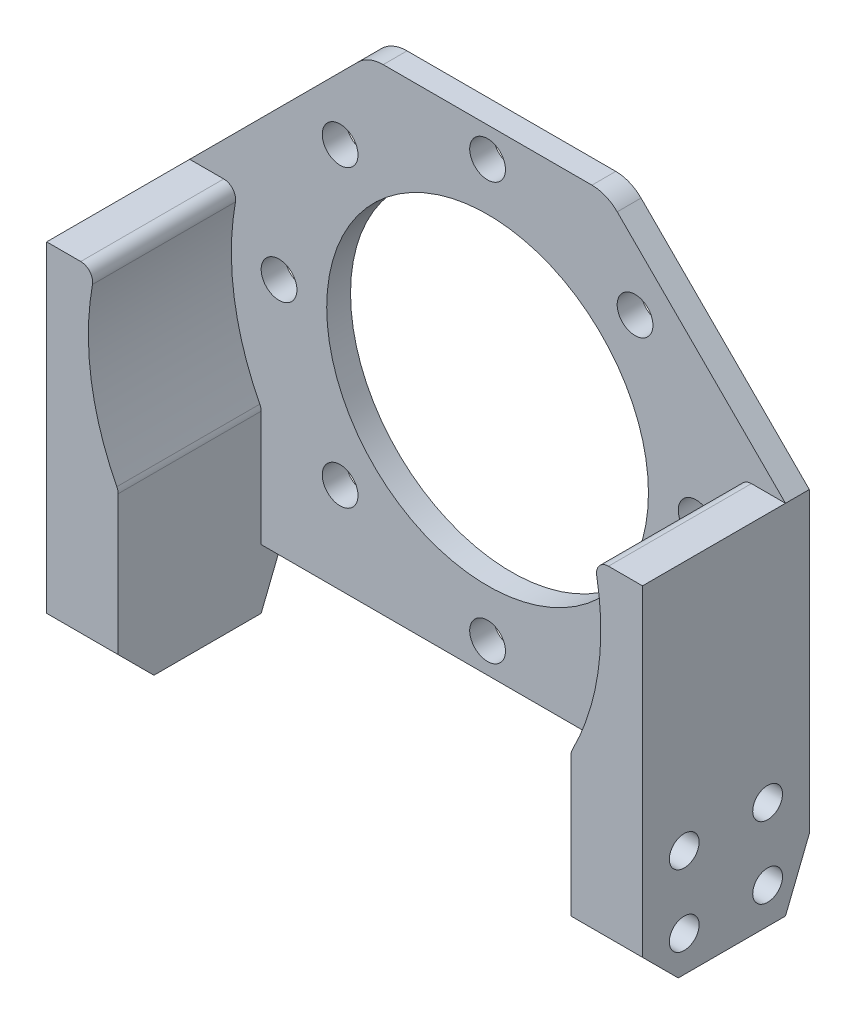
from build123d import *
from build123d.topology import SkipClean

# Parameters (mm, degrees)
SKETCH_1_W          = 50
SKETCH_1_H          = 50
SKETCH_1_R          = 21.5
SKETCH_1_R_2        = 13.5
SKETCH_1_R_3        = 1.5
EXTRUDE_1_DEPTH     = 8
SKETCH_2_R          = 21.5
CUT_EXTRUDE_1_DEPTH = 6
SKETCH_3_W          = 50
SKETCH_3_H          = 5
CUT_EXTRUDE_2_DEPTH = 27
CUT_EXTRUDE_3_DEPTH = 10
SKETCH_5_W          = 59.949446365
SKETCH_5_H          = 15
CUT_EXTRUDE_4_DEPTH = 6
SKETCH_6_R          = 13.5
CUT_EXTRUDE_5_DEPTH = 10
SKETCH_7_W          = 38
SKETCH_7_H          = 25.671468353
CUT_EXTRUDE_6_DEPTH = 6
EXTRUDE_START       = 6
EXTRUDE_2_DEPTH     = 6
SKETCH_9_R          = 1.25
CUT_EXTRUDE_7_DEPTH = 5
FILLET_1_R          = 1
FILLET_2_R          = 3
CHAMFER_1_SIZE      = 3
CUT_EXTRUDE_8_DEPTH = 51
CUT_EXTRUDE_9_DEPTH = 38


with BuildPart() as part:
    # 草图1 → 凸台-拉伸1 (new body)
    # profile 1 of 3: a face of its own
    with BuildSketch(Plane.XY):
        Rectangle(SKETCH_1_W, SKETCH_1_H)
        Circle(SKETCH_1_R, mode=Mode.SUBTRACT)
    # profile 2 of 3: a face of its own
    with BuildSketch(Plane.XY):
        Circle(SKETCH_1_R)
        Circle(SKETCH_1_R_2, mode=Mode.SUBTRACT)
        with Locations((0, 17.5)):
            Circle(SKETCH_1_R_3, mode=Mode.SUBTRACT)
        with Locations((12.374368671, 12.374368671)):
            Circle(SKETCH_1_R_3, mode=Mode.SUBTRACT)
        with Locations((17.5, 0)):
            Circle(SKETCH_1_R_3, mode=Mode.SUBTRACT)
        with Locations((12.374368671, -12.374368671)):
            Circle(SKETCH_1_R_3, mode=Mode.SUBTRACT)
        with Locations((0, -17.5)):
            Circle(SKETCH_1_R_3, mode=Mode.SUBTRACT)
        with Locations((-12.374368671, -12.374368671)):
            Circle(SKETCH_1_R_3, mode=Mode.SUBTRACT)
        with Locations((-17.5, 0)):
            Circle(SKETCH_1_R_3, mode=Mode.SUBTRACT)
        with Locations((-12.374368671, 12.374368671)):
            Circle(SKETCH_1_R_3, mode=Mode.SUBTRACT)
    # profile 3 of 3: a face of its own
    with BuildSketch(Plane.XY):
        Circle(SKETCH_1_R_2)
    extrude(amount=EXTRUDE_1_DEPTH)

    # 草图2 → 切除-拉伸1 (cut)
    with BuildSketch(Plane.XY.offset(8)):
        Circle(SKETCH_2_R)
    extrude(amount=-CUT_EXTRUDE_1_DEPTH, mode=Mode.SUBTRACT)

    # 草图3 → 切除-拉伸2 (cut)
    with BuildSketch(Plane.XY.offset(8)):
        with Locations((0, 22.5)):
            Rectangle(SKETCH_3_W, SKETCH_3_H)
    extrude(amount=-CUT_EXTRUDE_2_DEPTH, mode=Mode.SUBTRACT)

    # 草图4 → 切除-拉伸3 (cut)
    with BuildSketch(Plane.XY.offset(8)):
        Polygon((-25, 5), (-25, 20), (-10, 20), align=None)
        Polygon((10, 20), (25, 5), (25, 20), align=None)
    extrude(amount=-CUT_EXTRUDE_3_DEPTH, mode=Mode.SUBTRACT)

    # 草图5 → 切除-拉伸4 (cut)
    with BuildSketch(Plane.XY.offset(8)):
        with Locations((-0.284795469, 12.5)):
            Rectangle(SKETCH_5_W, SKETCH_5_H)
    extrude(amount=-CUT_EXTRUDE_4_DEPTH, mode=Mode.SUBTRACT)

    # 草图6 → 切除-拉伸5 (cut)
    with BuildSketch(Plane.XY.offset(2)):
        Circle(SKETCH_6_R)
    extrude(amount=-CUT_EXTRUDE_5_DEPTH, mode=Mode.SUBTRACT)

    # 草图7 → 切除-拉伸6 (cut)
    with BuildSketch(Plane.XY.offset(8)):
        with Locations((0, -22.898040076)):
            Rectangle(SKETCH_7_W, SKETCH_7_H)
    extrude(amount=-CUT_EXTRUDE_6_DEPTH, mode=Mode.SUBTRACT)

    # 草图8 → 凸台-拉伸2 (add)
    with BuildSketch(Plane.XY.offset(8).offset(EXTRUDE_START)):
        with BuildLine():
            Line((19, -10.062305899), (19, -25))
            Line((19, -25), (25, -25))
            Line((25, -25), (25, 5))
            Line((25, 5), (20.910523666, 5))
            ThreePointArc((20.910523666, 5), (21.329105457, -2.70541317), (19, -10.062305899))
        make_face()
        with BuildLine():
            Line((-19, -25), (-19, -10.062305899))
            ThreePointArc((-19, -10.062305899), (-21.329105457, -2.70541317), (-20.910523666, 5))
            Line((-20.910523666, 5), (-25, 5))
            Line((-25, 5), (-25, -25))
            Line((-25, -25), (-19, -25))
        make_face()
    extrude(amount=-EXTRUDE_2_DEPTH)

    # 草图9 → 切除-拉伸7 (cut)
    with SkipClean():  # the faces are left unmerged after this step: merging them gives an invalid solid
        with BuildSketch(Plane(origin=(25, 0, 0), x_dir=(0, 0, -1), z_dir=(1, 0, 0))):
            with Locations(Location((-3.5, -16, 0), (0, 0, 90))):
                Circle(SKETCH_9_R)
            with Locations(Location((-3.5, -22, 0), (0, 0, 90))):
                Circle(SKETCH_9_R)
            with Locations(Location((-10.5, -16, 0), (0, 0, 90))):
                Circle(SKETCH_9_R)
            with Locations(Location((-10.5, -22, 0), (0, 0, 90))):
                Circle(SKETCH_9_R)
        cut_extrude_7 = extrude(amount=-CUT_EXTRUDE_7_DEPTH, mode=Mode.SUBTRACT)

    # 镜向1: 切除-拉伸7 across plane
    with SkipClean():  # the faces are left unmerged after this step: merging them gives an invalid solid
        add(cut_extrude_7.mirror(Plane(origin=(0, 0, 0), x_dir=(0, 0, 1), z_dir=(1, 0, 0))), mode=Mode.SUBTRACT)

    # 圆角1
    fillet_1_edges = [part.edges().sort_by_distance(p)[0] for p in [
        (20.910523666, 5, 8),
        (-20.910523666, 5, 11),
        (19, -10.062305899, 8),
        (-19, -10.062305899, 5),
    ]]
    fillet(fillet_1_edges, radius=FILLET_1_R)

    # 圆角2
    fillet_2_edges = [part.edges().sort_by_distance(p)[0] for p in [
        (10, 20, 1),
        (-10, 20, 1),
    ]]
    fillet(fillet_2_edges, radius=FILLET_2_R)

    # 倒角1
    chamfer_1_edges = [part.edges().sort_by_distance(p)[0] for p in [
        (22, -25, 14),
        (-22, -25, 14),
    ]]
    chamfer(chamfer_1_edges, length=CHAMFER_1_SIZE)

    # 草图10 → 切除-拉伸8 (cut)
    with BuildSketch(Plane(origin=(25, 0, 0), x_dir=(0, 0, -1), z_dir=(1, 0, 0))):
        Polygon((-2, -25), (0, -25), (0, -20), align=None)
    extrude(amount=-CUT_EXTRUDE_8_DEPTH, mode=Mode.SUBTRACT)

    # 草图11 → 切除-拉伸9 (cut)
    with BuildSketch(Plane.ZY.offset(-19)):
        Polygon((2, -25), (2, -20), (0, -20), align=None)
    extrude(amount=CUT_EXTRUDE_9_DEPTH, mode=Mode.SUBTRACT)


solid = part.part
